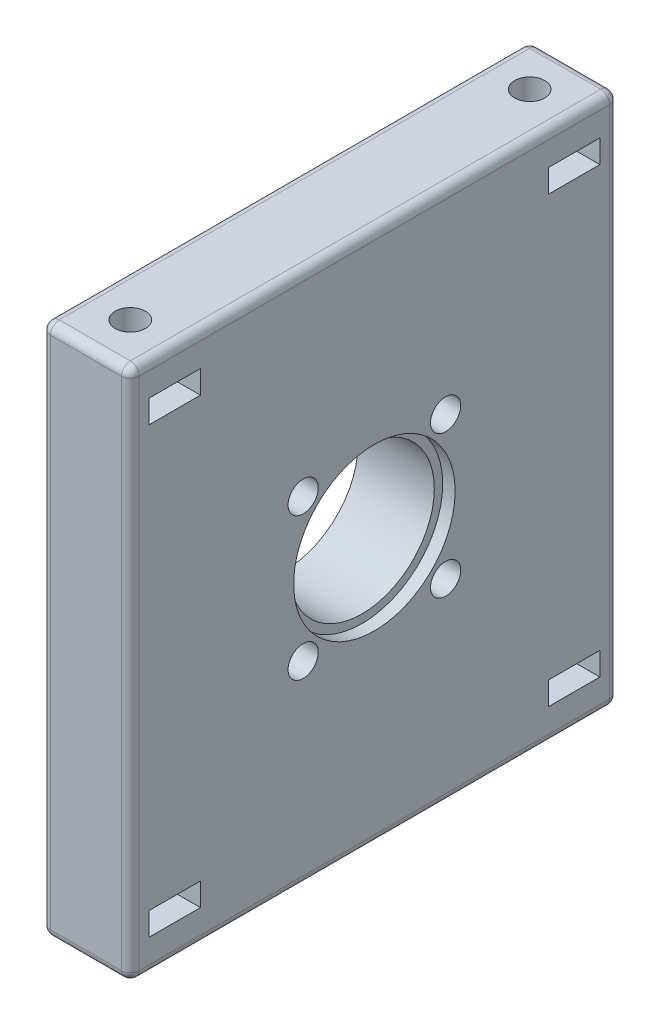
from build123d import *

# Parameters (mm, degrees)
SKETCH1_W           = 55
SKETCH1_H           = 60
BOSS_EXTRUDE1_DEPTH = 10
SKETCH2_R           = 1.7
CUT_EXTRUDE1_DEPTH  = 10
CUT_EXTRUDE2_START  = -10
SKETCH3_R           = 1.7
CUT_EXTRUDE2_DEPTH  = 10
SKETCH4_W           = 5.8
SKETCH4_H           = 2.6
CUT_EXTRUDE3_DEPTH  = 9
SKETCH5_R           = 8.15
CUT_EXTRUDE4_DEPTH  = 24
SKETCH6_R           = 9.1
CUT_EXTRUDE5_DEPTH  = 1.4
FILLET1_R           = 1
SKETCH7_R           = 1.7
CUT_EXTRUDE6_DEPTH  = 27


with BuildPart() as part:
    # Sketch1 → Boss-Extrude1 (new body)
    with BuildSketch(Plane(origin=(0, 0, 0), x_dir=(0, 0, -1), z_dir=(1, 0, 0))):
        Rectangle(SKETCH1_W, SKETCH1_H)
    extrude(amount=BOSS_EXTRUDE1_DEPTH)

    # Sketch2 → Cut-Extrude1 (cut)
    with BuildSketch(Plane(origin=(0, 30, 0), x_dir=(1, 0, 0), z_dir=(0, 1, 0))):
        with Locations(Location((5, 22.5, 0), (0, 0, 270))):
            Circle(SKETCH2_R)
        with Locations(Location((5, -22.5, 0), (0, 0, 270))):
            Circle(SKETCH2_R)
    extrude(amount=-CUT_EXTRUDE1_DEPTH, mode=Mode.SUBTRACT)

    # Sketch3 → Cut-Extrude2 (cut)
    with BuildSketch(Plane.XZ.offset(30).offset(CUT_EXTRUDE2_START)):
        with Locations(Location((5, 22.5, 0), (0, 0, 90))):
            Circle(SKETCH3_R)
        with Locations(Location((5, -22.5, 0), (0, 0, 90))):
            Circle(SKETCH3_R)
    extrude(amount=CUT_EXTRUDE2_DEPTH, mode=Mode.SUBTRACT)

    # Sketch4 → Cut-Extrude3 (cut)
    with BuildSketch(Plane(origin=(10, 0, 0), x_dir=(0, 0, -1), z_dir=(1, 0, 0))):
        with Locations((-22.5, 25)):
            Rectangle(SKETCH4_W, SKETCH4_H)
        with Locations((22.5, 25)):
            Rectangle(SKETCH4_W, SKETCH4_H)
        with Locations((-22.5, -25)):
            Rectangle(SKETCH4_W, SKETCH4_H)
        with Locations((22.5, -25)):
            Rectangle(SKETCH4_W, SKETCH4_H)
    extrude(amount=-CUT_EXTRUDE3_DEPTH, mode=Mode.SUBTRACT)

    # Sketch5 → Cut-Extrude4 (cut)
    with BuildSketch(Plane(origin=(10, 0, 0), x_dir=(0, 0, -1), z_dir=(1, 0, 0))):
        Circle(SKETCH5_R)
    extrude(amount=-CUT_EXTRUDE4_DEPTH, mode=Mode.SUBTRACT)

    # Sketch6 → Cut-Extrude5 (cut)
    with BuildSketch(Plane(origin=(10, 0, 0), x_dir=(0, 0, -1), z_dir=(1, 0, 0))):
        Circle(SKETCH6_R)
    extrude(amount=-CUT_EXTRUDE5_DEPTH, mode=Mode.SUBTRACT)

    # Fillet1
    fillet1_edges = [part.edges().sort_by_distance(p)[0] for p in [
        (10, 0, 27.5),
        (10, -30, 0),
        (10, 0, -27.5),
        (0, -30, 0),
        (0, 0, 27.5),
        (0, 30, 0),
        (0, 0, -27.5),
        (5, -30, -27.5),
        (5, -30, 27.5),
        (5, 30, 27.5),
        (5, 30, -27.5),
        (10, 30, 0),
    ]]
    fillet(fillet1_edges, radius=FILLET1_R)

    # Sketch7 → Cut-Extrude6 (cut)
    with BuildSketch(Plane(origin=(10, 0, 0), x_dir=(0, 0, -1), z_dir=(1, 0, 0))):
        with Locations((-8.025, 8.03)):
            Circle(SKETCH7_R)
        with Locations((8.025, 8.03)):
            Circle(SKETCH7_R)
        with Locations((8.025, -8.03)):
            Circle(SKETCH7_R)
        with Locations((-8.025, -8.03)):
            Circle(SKETCH7_R)
    extrude(amount=-CUT_EXTRUDE6_DEPTH, mode=Mode.SUBTRACT)


solid = part.part
